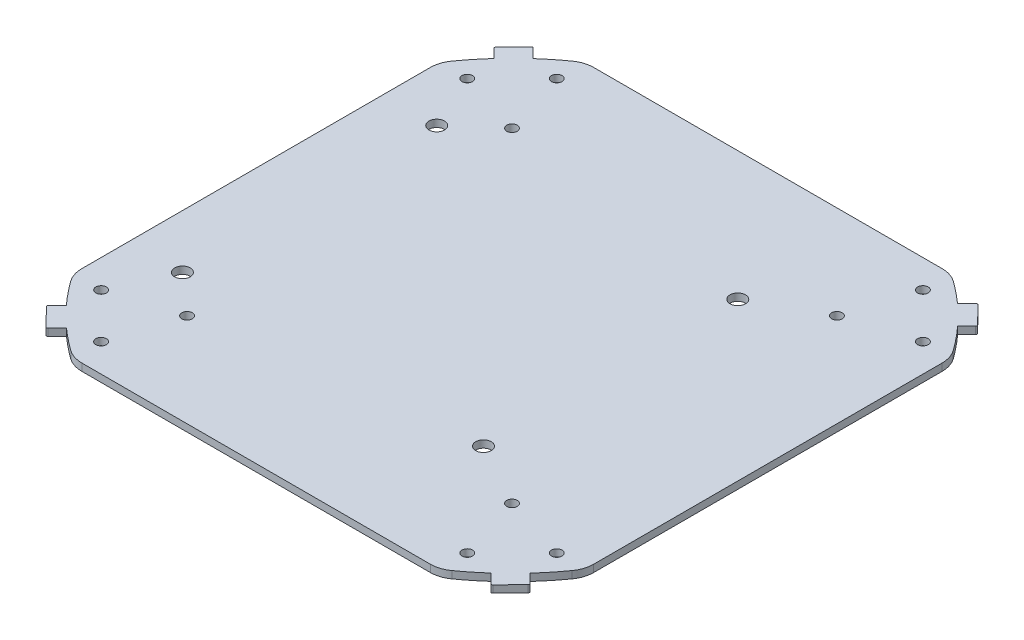
from build123d import *

# Parameters (mm, degrees)
SKETCH1_R           = 1.016000002
SKETCH1_R_2         = 1.015999994
SKETCH1_R_3         = 1.016000004
SKETCH1_R_4         = 1.016000003
SKETCH1_R_5         = 1.5
BOSS_EXTRUDE1_DEPTH = 1.397


with BuildPart() as part:
    # Sketch1 → Boss-Extrude1 (new body)
    with BuildSketch(Plane(origin=(0, 0, 0), x_dir=(1, 0, 0), z_dir=(0, 1, 0))):
        with BuildLine():
            Line((-44.657487237, -41.209177315), (-46.396043566, -42.947733643))
            ThreePointArc((-46.396043566, -42.947733643), (-46.47043426, -43.125880979), (-46.398093321, -43.304870469))
            Line((-46.398093321, -43.304870469), (-43.050556902, -46.730153436))
            ThreePointArc((-43.050556902, -46.730153436), (-42.865374913, -46.831022486), (-42.667823962, -46.757262364))
            Line((-42.667823962, -46.757262364), (-40.871772737, -44.96121114))
            ThreePointArc((-40.871772737, -44.96121114), (-38.831009329, -46.687575031), (-36.702263747, -48.304204185))
            ThreePointArc((-36.702263747, -48.304204185), (-35.216668272, -49.053976946), (-33.572746514, -49.312190732))
            Line((-33.572746514, -49.312190732), (33.572746514, -49.312190732))
            ThreePointArc((33.572746514, -49.312190732), (35.216668272, -49.053976946), (36.702263747, -48.304204185))
            ThreePointArc((36.702263747, -48.304204185), (38.831009329, -46.687575031), (40.871772737, -44.96121114))
            Line((40.871772737, -44.96121114), (42.667823962, -46.757262364))
            ThreePointArc((42.667823962, -46.757262364), (42.865374913, -46.831022486), (43.050556902, -46.730153436))
            Line((43.050556902, -46.730153436), (46.398093321, -43.304870469))
            ThreePointArc((46.398093321, -43.304870469), (46.47043426, -43.125880979), (46.396043566, -42.947733643))
            Line((46.396043566, -42.947733643), (44.657487237, -41.209177315))
            ThreePointArc((44.657487237, -41.209177315), (46.545191327, -39.007785053), (48.304204175, -36.702263762))
            ThreePointArc((48.304204175, -36.702263762), (49.053976936, -35.216668286), (49.312190722, -33.572746527))
            Line((49.312190722, -33.572746527), (49.312190722, 33.572746527))
            ThreePointArc((49.312190722, 33.572746527), (49.053976936, 35.216668286), (48.304204175, 36.702263762))
            ThreePointArc((48.304204175, 36.702263762), (46.545191327, 39.007785053), (44.657487237, 41.209177315))
            Line((44.657487237, 41.209177315), (46.396043566, 42.947733643))
            ThreePointArc((46.396043566, 42.947733643), (46.47043426, 43.125880979), (46.398093321, 43.304870469))
            Line((46.398093321, 43.304870469), (43.050556902, 46.730153436))
            ThreePointArc((43.050556902, 46.730153436), (42.865374913, 46.831022486), (42.667823962, 46.757262364))
            Line((42.667823962, 46.757262364), (40.871772737, 44.96121114))
            ThreePointArc((40.871772737, 44.96121114), (38.831009329, 46.687575031), (36.702263747, 48.304204185))
            ThreePointArc((36.702263747, 48.304204185), (35.216668272, 49.053976946), (33.572746514, 49.312190732))
            Line((33.572746514, 49.312190732), (-33.572746514, 49.312190732))
            ThreePointArc((-33.572746514, 49.312190732), (-35.216668272, 49.053976946), (-36.702263747, 48.304204185))
            ThreePointArc((-36.702263747, 48.304204185), (-38.831009329, 46.687575031), (-40.871772737, 44.96121114))
            Line((-40.871772737, 44.96121114), (-42.667823962, 46.757262364))
            ThreePointArc((-42.667823962, 46.757262364), (-42.865374913, 46.831022486), (-43.050556902, 46.730153436))
            Line((-43.050556902, 46.730153436), (-46.398093321, 43.304870469))
            ThreePointArc((-46.398093321, 43.304870469), (-46.47043426, 43.125880979), (-46.396043566, 42.947733643))
            Line((-46.396043566, 42.947733643), (-44.657487237, 41.209177315))
            ThreePointArc((-44.657487237, 41.209177315), (-46.545191327, 39.007785053), (-48.304204175, 36.702263762))
            ThreePointArc((-48.304204175, 36.702263762), (-49.053976936, 35.216668286), (-49.312190722, 33.572746527))
            Line((-49.312190722, 33.572746527), (-49.312190722, -33.572746527))
            ThreePointArc((-49.312190722, -33.572746527), (-49.053976936, -35.216668286), (-48.304204175, -36.702263762))
            ThreePointArc((-48.304204175, -36.702263762), (-46.545191327, -39.007785053), (-44.657487237, -41.209177315))
        make_face()
        with Locations(Location((-35.273880312, -43.8949262, 0), (0, 0, 90))):
            Circle(SKETCH1_R, mode=Mode.SUBTRACT)
        with Locations(Location((-43.89492619, -35.273880325, 0), (0, 0, 270))):
            Circle(SKETCH1_R_2, mode=Mode.SUBTRACT)
        with Locations(Location((-31.299173987, -31.299173994, 0), (0, 0, 270))):
            Circle(SKETCH1_R, mode=Mode.SUBTRACT)
        with Locations(Location((43.89492619, -35.273880325, 0), (0, 0, 90))):
            Circle(SKETCH1_R_3, mode=Mode.SUBTRACT)
        with Locations(Location((35.273880312, -43.8949262, 0), (0, 0, 270))):
            Circle(SKETCH1_R_3, mode=Mode.SUBTRACT)
        with Locations(Location((31.299173987, -31.299173994, 0), (0, 0, 90))):
            Circle(SKETCH1_R, mode=Mode.SUBTRACT)
        with Locations(Location((-35.273880312, 43.8949262, 0), (0, 0, 270))):
            Circle(SKETCH1_R, mode=Mode.SUBTRACT)
        with Locations(Location((-31.299173987, 31.299173994, 0), (0, 0, 90))):
            Circle(SKETCH1_R, mode=Mode.SUBTRACT)
        with Locations(Location((-43.89492619, 35.273880325, 0), (0, 0, 90))):
            Circle(SKETCH1_R, mode=Mode.SUBTRACT)
        with Locations(Location((43.89492619, 35.273880325, 0), (0, 0, 270))):
            Circle(SKETCH1_R_4, mode=Mode.SUBTRACT)
        with Locations(Location((35.273880312, 43.8949262, 0), (0, 0, 90))):
            Circle(SKETCH1_R_3, mode=Mode.SUBTRACT)
        with Locations(Location((31.299173987, 31.299173994, 0), (0, 0, 270))):
            Circle(SKETCH1_R, mode=Mode.SUBTRACT)
        with Locations(Location((-39, 24.5, 0), (0, 0, 270))):
            Circle(SKETCH1_R_5, mode=Mode.SUBTRACT)
        with Locations(Location((19, 24.5, 0), (0, 0, 270))):
            Circle(SKETCH1_R_5, mode=Mode.SUBTRACT)
        with Locations(Location((19.002972949, -24.499403884, 0), (0, 0, 270))):
            Circle(SKETCH1_R_5, mode=Mode.SUBTRACT)
        with Locations(Location((-39, -24.5, 0), (0, 0, 270))):
            Circle(SKETCH1_R_5, mode=Mode.SUBTRACT)
    extrude(amount=BOSS_EXTRUDE1_DEPTH)


solid = part.part
